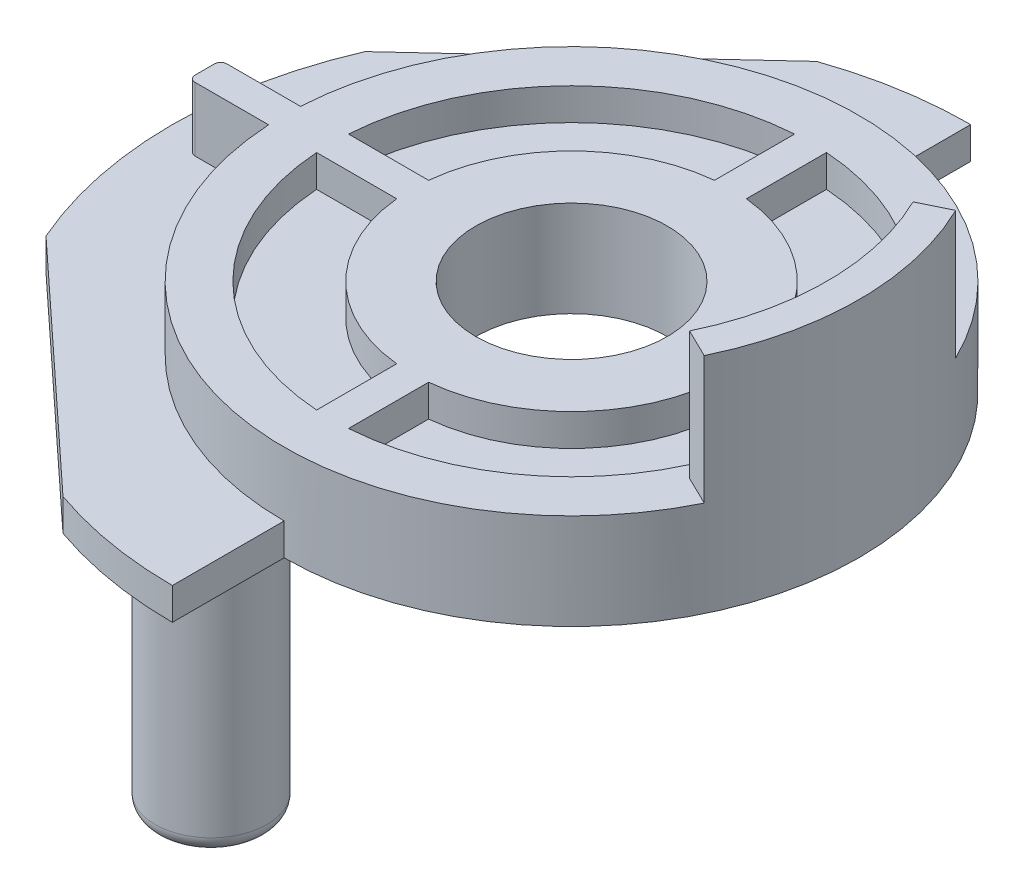
from build123d import *

# Parameters (mm, degrees)
SCHIZZO1_R                   = 9
SCHIZZO1_R_2                 = 3
ESTRUSIONE_ESTRUSIONE1_DEPTH = 7
TAGLIO_ESTRUSIONE1_START     = -4
TAGLIO_ESTRUSIONE1_DEPTH     = 4
TAGLIO_ESTRUSIONE2_DEPTH     = 1
RIPETIZIONECIRCOLARE1_COUNT  = 4
ESTRUSIONE_ESTRUSIONE2_DEPTH = 1
ESTRUSIONE_ESTRUSIONE3_DEPTH = 2
SCHIZZO7_R                   = 1.75
ESTRUSIONE_ESTRUSIONE4_DEPTH = 15
RACCORDO1_R                  = 0.5


with BuildPart() as part:
    # Schizzo1 → Estrusione-Estrusione1 (new body)
    with BuildSketch(Plane(origin=(0, 0, 0), x_dir=(1, 0, 0), z_dir=(0, 1, 0))):
        with Locations(Location((0, 0, 0), (0, 0, 270))):
            Circle(SCHIZZO1_R)
        with Locations(Location((0, 0, 0), (0, 0, 270))):
            Circle(SCHIZZO1_R_2, mode=Mode.SUBTRACT)
    extrude(amount=ESTRUSIONE_ESTRUSIONE1_DEPTH)

    # Schizzo3 → Taglio-Estrusione1 (cut)
    with BuildSketch(Plane(origin=(0, 7, 0), x_dir=(1, 0, 0), z_dir=(0, 1, 0)).offset(TAGLIO_ESTRUSIONE1_START)):
        with BuildLine():
            Line((7.193747285, 3.5), (8.092965696, 3.9375))
            ThreePointArc((8.092965696, 3.9375), (-9, 0), (8.092965696, -3.9375))
            Line((8.092965696, -3.9375), (7.193747285, -3.5))
            ThreePointArc((7.193747285, -3.5), (8, 0), (7.193747285, 3.5))
        make_face()
    extrude(amount=TAGLIO_ESTRUSIONE1_DEPTH, mode=Mode.SUBTRACT)

    # Schizzo4 → Taglio-Estrusione2 (cut)
    with BuildSketch(Plane(origin=(0, 3, 0), x_dir=(1, 0, 0), z_dir=(0, 1, 0))):
        with BuildLine():
            Line((-0.5, 4.974937186), (-0.5, 7.483314774))
            ThreePointArc((-0.5, 7.483314774), (-5.303300859, 5.303300859), (-7.483314774, 0.5))
            Line((-7.483314774, 0.5), (-4.974937186, 0.5))
            ThreePointArc((-4.974937186, 0.5), (-3.535533906, 3.535533906), (-0.5, 4.974937186))
        make_face()
    taglio_estrusione2 = extrude(amount=-TAGLIO_ESTRUSIONE2_DEPTH, mode=Mode.SUBTRACT)

    # RipetizioneCircolare1: Taglio-Estrusione2 ×4 about axis
    ripetizionecircolare1_axis = Axis((0, 0, 0), (0, 1, 0))
    for i in range(1, RIPETIZIONECIRCOLARE1_COUNT):
        add(taglio_estrusione2.rotate(ripetizionecircolare1_axis, i * 360 / RIPETIZIONECIRCOLARE1_COUNT), mode=Mode.SUBTRACT)

    # Schizzo5 → Estrusione-Estrusione2 (add)
    with BuildSketch(Plane(origin=(0, 0, 0), x_dir=(1, 0, 0), z_dir=(0, 1, 0))):
        with BuildLine():
            Line((0, 9), (0, 12.5))
            ThreePointArc((0, 12.5), (-2.091650066, 12.323757544), (-4.124318125, 11.8))
            Line((-4.124318125, 11.8), (-11.456439237, 5))
            ThreePointArc((-11.456439237, 5), (-12.5, 0), (-11.456439237, -5))
            Line((-11.456439237, -5), (-4.124318125, -11.8))
            ThreePointArc((-4.124318125, -11.8), (-2.091650066, -12.323757544), (0, -12.5))
            Line((0, -12.5), (0, -9))
            ThreePointArc((0, -9), (-9, 0), (0, 9))
        make_face()
    extrude(amount=ESTRUSIONE_ESTRUSIONE2_DEPTH)

    # Schizzo6 → Estrusione-Estrusione3 (add)
    with BuildSketch(Plane(origin=(0, 1, 0), x_dir=(1, 0, 0), z_dir=(0, 1, 0))):
        with BuildLine():
            Line((-8.986100378, 0.5), (-11.286100378, 0.5))
            ThreePointArc((-11.286100378, 0.5), (-11.427521734, 0.441421356), (-11.486100378, 0.3))
            Line((-11.486100378, 0.3), (-11.486100378, -0.3))
            ThreePointArc((-11.486100378, -0.3), (-11.427521734, -0.441421356), (-11.286100378, -0.5))
            Line((-11.286100378, -0.5), (-8.986100378, -0.5))
            ThreePointArc((-8.986100378, -0.5), (-9, 0), (-8.986100378, 0.5))
        make_face()
    extrude(amount=ESTRUSIONE_ESTRUSIONE3_DEPTH)

    # Schizzo7 → Estrusione-Estrusione4 (add)
    with BuildSketch(Plane.XZ):
        with Locations(Location((-9.287087811, 2, 0), (0, 0, 90))):
            Circle(SCHIZZO7_R)
    extrude(amount=ESTRUSIONE_ESTRUSIONE4_DEPTH)

    # Raccordo1
    raccordo1_edges = [part.edges().sort_by_distance(p)[0] for p in [
        (-9.287087811, -15, 0.25),
    ]]
    fillet(raccordo1_edges, radius=RACCORDO1_R)


solid = part.part
